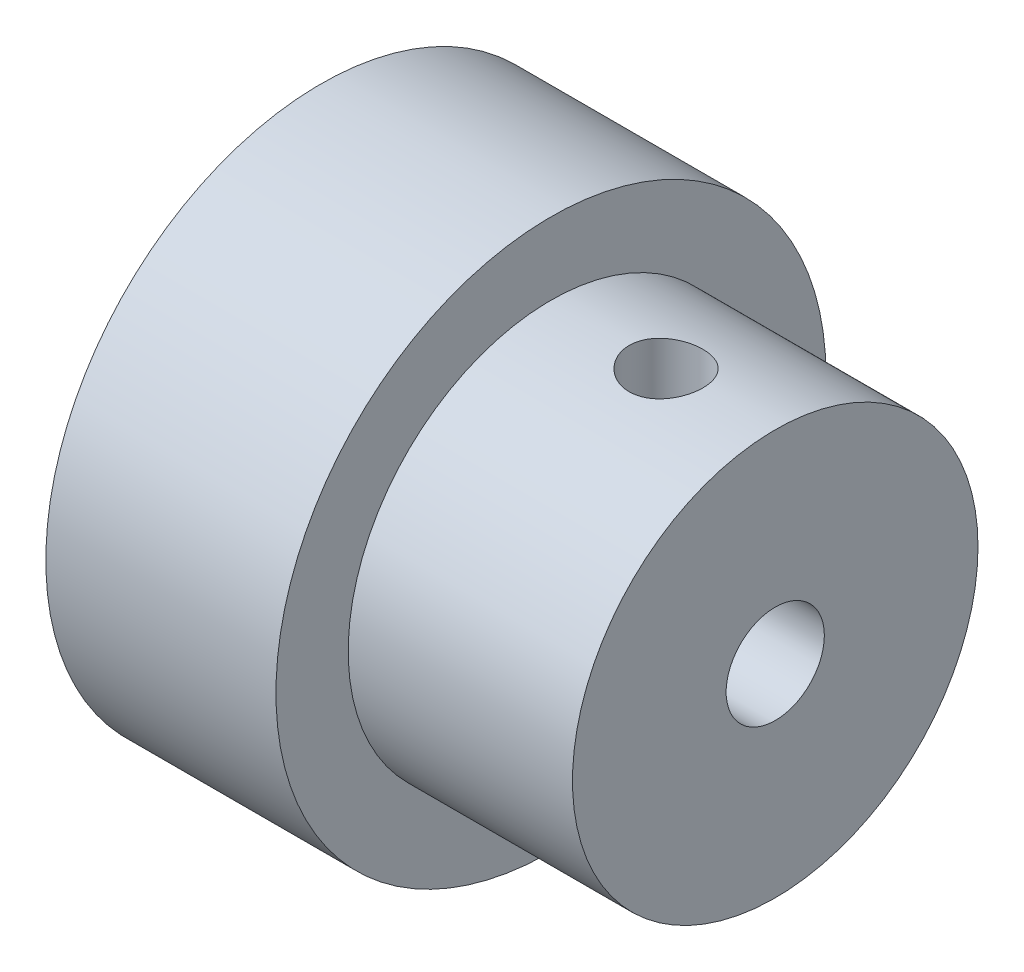
from build123d import *

# Parameters (mm, degrees)
CUT_EXTRUDE1_DEPTH      = 20.334926531
CUT_EXTRUDE1_DEPTH_BACK = 20.334926531
SKETCH2_R               = 1.190625


with BuildPart() as part:
    # Sketch1 → Revolve1 (revolve)
    with BuildSketch(Plane.XY):
        Polygon((0, 1.5875), (0, 6.554286829), (-7.250077802, 6.554286829), (-7.250077802, 8.89), (-14.689288069, 8.89), (-14.689288069, 1.5875), align=None)
    revolve(axis=Axis((0, 0, 0), (-1, 0, 0)))

    # Sketch2 → Cut-Extrude1 (cut, two sides: drawn at the far end of the back side and taken through both)
    with BuildSketch(Plane(origin=(0, 0, 0), x_dir=(1, 0, 0), z_dir=(0, 1, 0)).offset(-CUT_EXTRUDE1_DEPTH_BACK)):
        with Locations((-3.529556327, 0)):
            Circle(SKETCH2_R)
    extrude(amount=CUT_EXTRUDE1_DEPTH + CUT_EXTRUDE1_DEPTH_BACK, mode=Mode.SUBTRACT)


solid = part.part
